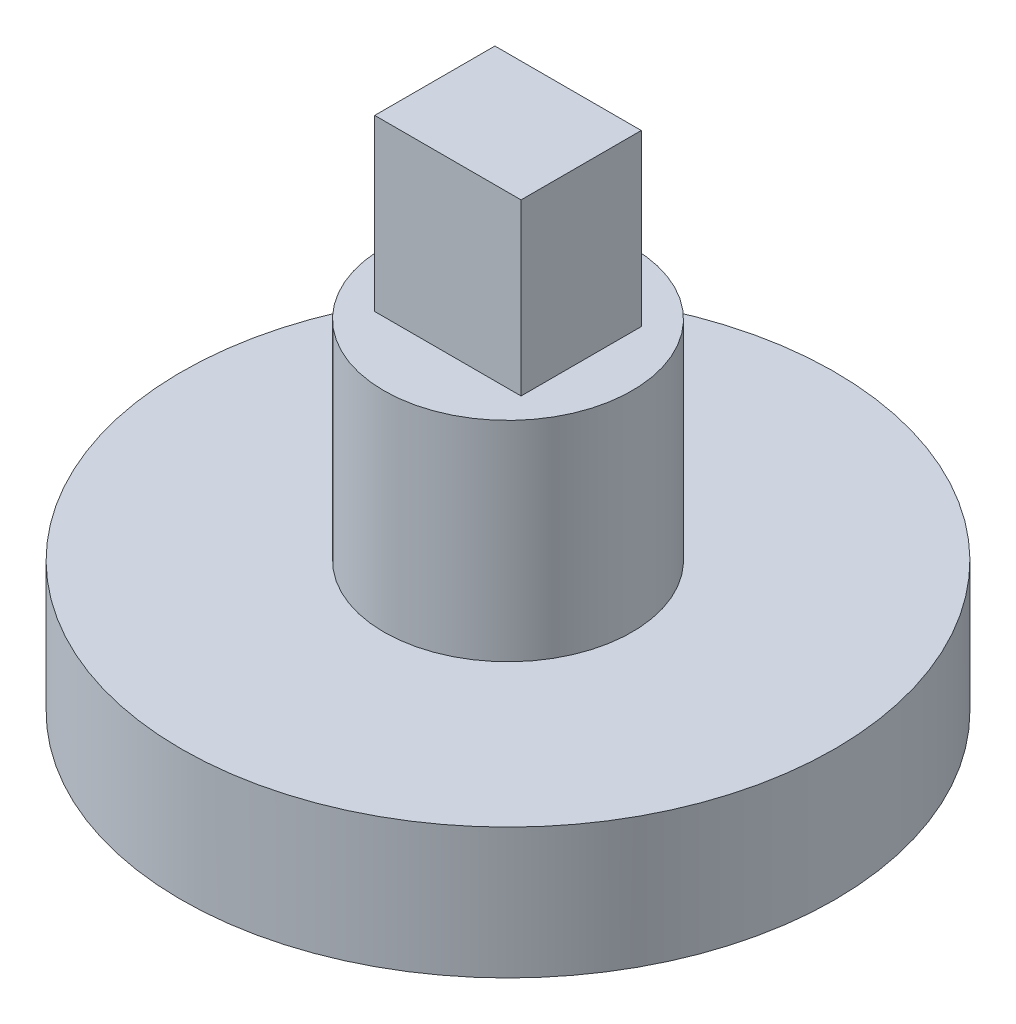
from build123d import *

# Parameters (mm, degrees)
SKETCH1_R           = 12.5
SKETCH1_R_2         = 4.75
BOSS_EXTRUDE1_DEPTH = 5
SKETCH1_3_R         = 4.75
SKETCH1_3_W         = 5.6
SKETCH1_3_H         = 4.6
BOSS_EXTRUDE2_DEPTH = 13
SKETCH1_4_W         = 5.6
SKETCH1_4_H         = 4.6
BOSS_EXTRUDE3_DEPTH = 19.5
CUT_EXTRUDE2_DEPTH  = 3
CUT_EXTRUDE3_DEPTH  = 4


with BuildPart() as part:
    # Sketch1 → Boss-Extrude1 (new body)
    with BuildSketch(Plane(origin=(0, 0, 0), x_dir=(1, 0, 0), z_dir=(0, 1, 0))):
        Circle(SKETCH1_R)
        Circle(SKETCH1_R_2, mode=Mode.SUBTRACT)
    extrude(amount=BOSS_EXTRUDE1_DEPTH)

    # Sketch1<3> → Boss-Extrude2 (add)
    with BuildSketch(Plane(origin=(0, 0, 0), x_dir=(1, 0, 0), z_dir=(0, 1, 0))):
        Circle(SKETCH1_3_R)
        Rectangle(SKETCH1_3_W, SKETCH1_3_H, mode=Mode.SUBTRACT)
    extrude(amount=BOSS_EXTRUDE2_DEPTH)

    # Sketch1<4> → Boss-Extrude3 (add)
    with BuildSketch(Plane(origin=(0, 0, 0), x_dir=(1, 0, 0), z_dir=(0, 1, 0))):
        Rectangle(SKETCH1_4_W, SKETCH1_4_H)
    extrude(amount=BOSS_EXTRUDE3_DEPTH)

    # Sketch2 → Cut-Extrude2 (cut)
    with BuildSketch(Plane(origin=(0, 0, 0), x_dir=(1, 0, 0), z_dir=(0, 1, 0))):
        with BuildLine():
            Line((-0.288199979, 3.488114214), (-12.247448714, 2.5))
            ThreePointArc((-12.247448714, 2.5), (-12.5, 0), (-12.247448714, -2.5))
            Line((-12.247448714, -2.5), (-0.288199979, -3.488114214))
            ThreePointArc((-0.288199979, -3.488114214), (3.5, 0), (-0.288199979, 3.488114214))
        make_face()
    extrude(amount=CUT_EXTRUDE2_DEPTH, mode=Mode.SUBTRACT)

    # Sketch2<3> → Cut-Extrude3 (cut)
    with BuildSketch(Plane(origin=(0, 0, 0), x_dir=(1, 0, 0), z_dir=(0, 1, 0))):
        with BuildLine():
            ThreePointArc((-0.288199979, 3.488114214), (-3.5, 0), (-0.288199979, -3.488114214))
            ThreePointArc((-0.288199979, -3.488114214), (2.370791015, -2.574752408), (3.5, 0))
            ThreePointArc((3.5, 0), (2.370791015, 2.574752408), (-0.288199979, 3.488114214))
        make_face()
    extrude(amount=CUT_EXTRUDE3_DEPTH, mode=Mode.SUBTRACT)


solid = part.part
